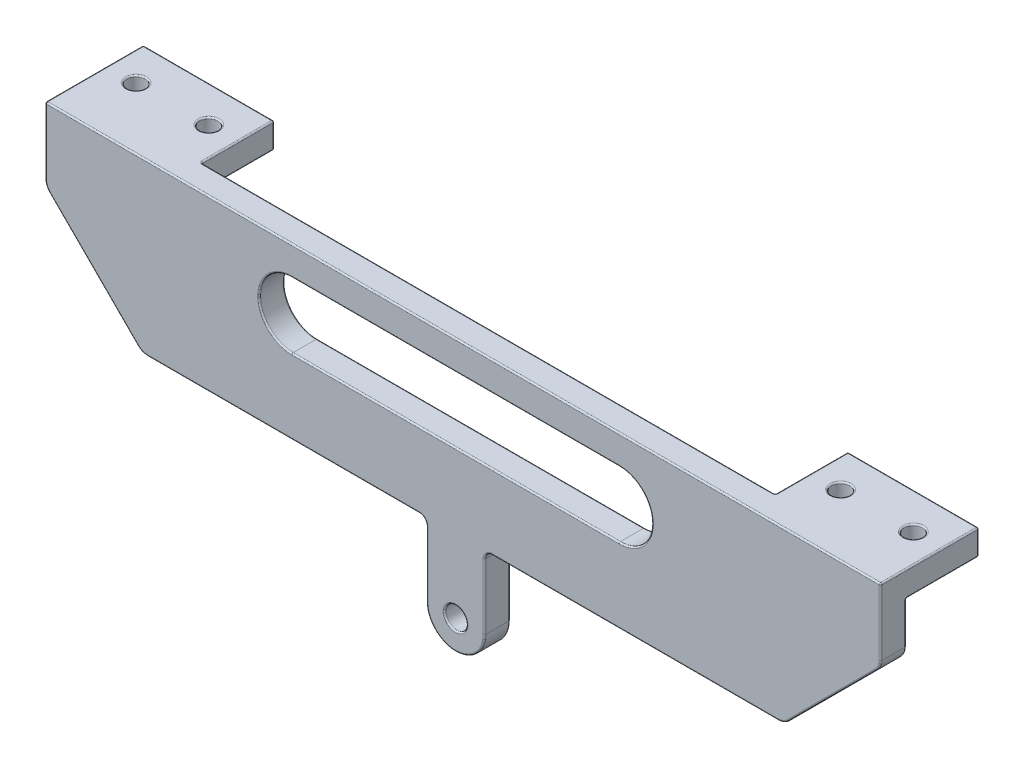
from build123d import *

# Parameters (mm, degrees)
SKETCH5_R           = 1.5
BOSS_EXTRUDE1_DEPTH = 3.5
SKETCH6_W           = 18
SKETCH6_H           = 10
SKETCH6_R           = 1.25
BOSS_EXTRUDE2_DEPTH = 3.5
FILLET1_R           = 2
FILLET2_R           = 1
FILLET3_R           = 0.2


with BuildPart() as part:
    # Sketch5 → Boss-Extrude1 (new body)
    with BuildSketch(Plane.XY):
        with BuildLine():
            Line((-6.722642002, 69.977757539), (-45.855701779, 69.977757539))
            Line((-45.855701779, 69.977757539), (-59.149309265, 83.271365025))
            Line((-59.149309265, 83.271365025), (-59.149309265, 93.271365025))
            Line((-59.149309265, 93.271365025), (55.722626744, 93.271365025))
            Line((55.722626744, 93.271365025), (55.722626744, 83.271365025))
            Line((55.722626744, 83.271365025), (42.429019258, 69.977757539))
            Line((42.429019258, 69.977757539), (1.277357998, 69.977757539))
            Line((1.277357998, 69.977757539), (1.277357998, 59.977757539))
            ThreePointArc((1.277357998, 59.977757539), (-2.722642002, 55.977757539), (-6.722642002, 59.977757539))
            Line((-6.722642002, 59.977757539), (-6.722642002, 69.977757539))
        make_face()
        with Locations((-2.722642002, 59.977757539)):
            Circle(SKETCH5_R, mode=Mode.SUBTRACT)
        with BuildLine():
            Line((-25.222642002, 89.271365025), (19.777357998, 89.271365025))
            ThreePointArc((19.777357998, 89.271365025), (24.277357998, 84.771365025), (19.777357998, 80.271365025))
            Line((19.777357998, 80.271365025), (-25.222642002, 80.271365025))
            ThreePointArc((-25.222642002, 80.271365025), (-29.722642002, 84.771365025), (-25.222642002, 89.271365025))
        make_face(mode=Mode.SUBTRACT)
    extrude(amount=BOSS_EXTRUDE1_DEPTH)

    # Sketch6 → Boss-Extrude2 (add)
    # profile 1 of 2: a face of its own
    with BuildSketch(Plane(origin=(0, 93.271365025, 0), x_dir=(1, 0, 0), z_dir=(0, 1, 0))):
        with Locations((-50.149309265, 5)):
            Rectangle(SKETCH6_W, SKETCH6_H)
        with Locations(Location((-55.149309265, 5, 0), (0, 0, 180))):
            Circle(SKETCH6_R, mode=Mode.SUBTRACT)
        with Locations(Location((-45.149309265, 5, 0), (0, 0, 180))):
            Circle(SKETCH6_R, mode=Mode.SUBTRACT)
    # profile 2 of 2: a face of its own
    with BuildSketch(Plane(origin=(0, 93.271365025, 0), x_dir=(1, 0, 0), z_dir=(0, 1, 0))):
        with Locations((46.722626744, 5)):
            Rectangle(SKETCH6_W, SKETCH6_H)
        with Locations((41.722626744, 5)):
            Circle(SKETCH6_R, mode=Mode.SUBTRACT)
        with Locations((51.722626744, 5)):
            Circle(SKETCH6_R, mode=Mode.SUBTRACT)
    extrude(amount=-BOSS_EXTRUDE2_DEPTH)

    # Fillet1
    fillet1_edges = [part.edges().sort_by_distance(p)[0] for p in [
        (55.722626744, 83.271365025, 1.75),
        (42.429019258, 69.977757539, 1.75),
        (-45.855701779, 69.977757539, 1.75),
        (-59.149309265, 83.271365025, 1.75),
    ]]
    fillet(fillet1_edges, radius=FILLET1_R)

    # Fillet2
    fillet2_edges = [part.edges().sort_by_distance(p)[0] for p in [
        (1.277357998, 69.977757539, 1.75),
        (-6.722642002, 69.977757539, 1.75),
    ]]
    fillet(fillet2_edges, radius=FILLET2_R)

    # Fillet3
    fillet3_edges = [part.edges().sort_by_distance(p)[0] for p in [
        (-6.722642002, 64.477757539, 0),
        (-6.722642002, 64.477757539, 3.5),
        (21.938975066, 69.977757539, 0),
        (21.938975066, 69.977757539, 3.5),
        (-7.01553522, 69.68486432, 0),
        (-7.01553522, 69.68486432, 3.5),
        (1.570251217, 69.68486432, 0),
        (1.570251217, 69.68486432, 3.5),
        (1.277357998, 64.477757539, 0),
        (-2.722642002, 55.977757539, 0),
        (55.722626744, 93.271365025, -3.25),
        (-59.149309265, 93.271365025, -3.25),
        (-2.722642002, 55.977757539, 3.5),
        (-4.222642002, 59.977757539, 0),
        (-4.222642002, 59.977757539, 3.5),
        (1.277357998, 64.477757539, 3.5),
        (-29.722642002, 84.771365025, 0),
        (-2.722642002, 80.271365025, 0),
        (24.277357998, 84.771365025, 0),
        (-2.722642002, 89.271365025, 0),
        (-29.722642002, 84.771365025, 3.5),
        (-2.722642002, 80.271365025, 3.5),
        (24.277357998, 84.771365025, 3.5),
        (-2.722642002, 89.271365025, 3.5),
        (-1.71334126, 93.271365025, 0),
        (-1.71334126, 93.271365025, 3.5),
        (-59.149309265, 86.935578588, 0),
        (-41.149309265, 93.271365025, -5),
        (-41.149309265, 91.521365025, -10),
        (-41.149309265, 91.521365025, 0),
        (-50.149309265, 93.271365025, -10),
        (-59.149309265, 91.521365025, -10),
        (-53.899309265, 89.771365025, -5),
        (-43.899309265, 89.771365025, -5),
        (-41.149309265, 89.771365025, -5),
        (-50.149309265, 89.771365025, 0),
        (-59.149309265, 89.771365025, -5),
        (-50.149309265, 89.771365025, -10),
        (-43.899309265, 93.271365025, -5),
        (-53.899309265, 93.271365025, -5),
        (50.472626744, 93.271365025, -5),
        (37.722626744, 93.271365025, -5),
        (46.722626744, 93.271365025, -10),
        (40.472626744, 93.271365025, -5),
        (37.722626744, 89.771365025, -5),
        (37.722626744, 91.521365025, 0),
        (46.722626744, 89.771365025, -10),
        (37.722626744, 91.521365025, -10),
        (55.722626744, 89.771365025, -5),
        (55.722626744, 91.521365025, -10),
        (46.722626744, 89.771365025, 0),
        (50.472626744, 89.771365025, -5),
        (40.472626744, 89.771365025, -5),
        (49.075823001, 76.624561282, 0),
        (49.075823001, 76.624561282, 3.5),
        (55.722626744, 86.935578588, 0),
        (-26.374958328, 69.977757539, 0),
        (-52.502505522, 76.624561282, 0),
        (-58.99706833, 83.334425285, 0),
        (-45.792641519, 70.129998474, 0),
        (55.570385809, 83.334425285, 0),
        (42.365958998, 70.129998474, 0),
        (-59.149309265, 88.685578588, 3.5),
        (-52.502505522, 76.624561282, 3.5),
        (-26.374958328, 69.977757539, 3.5),
        (55.722626744, 88.685578588, 3.5),
        (-58.99706833, 83.334425285, 3.5),
        (-45.792641519, 70.129998474, 3.5),
        (55.570385809, 83.334425285, 3.5),
        (42.365958998, 70.129998474, 3.5),
    ]]
    fillet(fillet3_edges, radius=FILLET3_R)


solid = part.part
